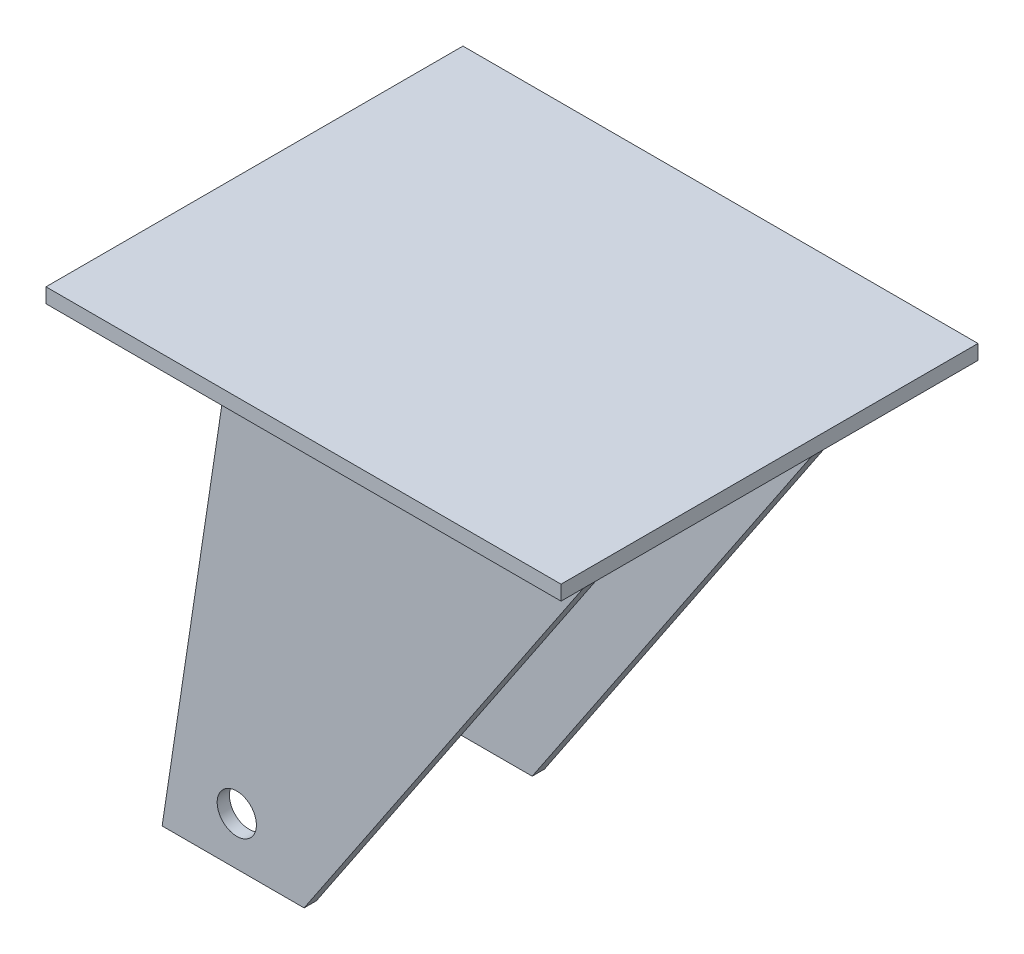
from build123d import *

# Parameters (mm, degrees)
SKETCH1_W           = 105
SKETCH1_H           = 85
BOSS_EXTRUDE1_DEPTH = 3
BOSS_EXTRUDE3_DEPTH = 2.5
BOSS_EXTRUDE2_DEPTH = 2.5
SKETCH4_R           = 4
CUT_EXTRUDE1_DEPTH  = 133.63411713


with BuildPart() as part:
    # Sketch1 → Boss-Extrude1 (new body)
    with BuildSketch(Plane(origin=(0, 0, 0), x_dir=(1, 0, 0), z_dir=(0, 1, 0))):
        with Locations((-6.063023564, 110.481367852)):
            Rectangle(SKETCH1_W, SKETCH1_H)
    extrude(amount=BOSS_EXTRUDE1_DEPTH)

    # Sketch3 → Boss-Extrude3 (add)
    with BuildSketch(Plane.XY.offset(-85.981367852)):
        Polygon((-38, 0), (42, 0), (-23.946113063, -98.352332448), (-52.884605872, -98.352332448), align=None)
    extrude(amount=-BOSS_EXTRUDE3_DEPTH)

    # Sketch2 → Boss-Extrude2 (add)
    with BuildSketch(Plane(origin=(0, 0, -134.981367852), x_dir=(-1, 0, 0), z_dir=(0, 0, -1))):
        Polygon((38, 0), (52.884605872, -98.352332448), (23.946113063, -98.352332448), (-42, 0), align=None)
    extrude(amount=-BOSS_EXTRUDE2_DEPTH)

    # Sketch4 → Cut-Extrude1 (cut, through all)
    with BuildSketch(Plane(origin=(0, 0, -134.981367852), x_dir=(-1, 0, 0), z_dir=(0, 0, -1))):
        with Locations((37.669993982, -88.574319881)):
            Circle(SKETCH4_R)
    extrude(amount=-CUT_EXTRUDE1_DEPTH, mode=Mode.SUBTRACT)


solid = part.part
